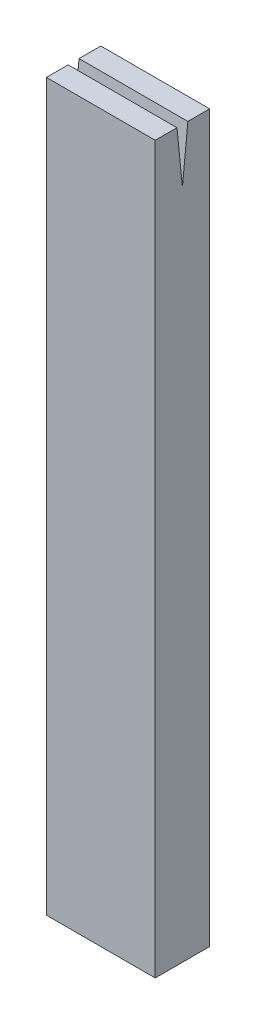
from build123d import *

# Parameters (mm, degrees)
SKETCH1_W           = 60
SKETCH1_H           = 30
BOSS_EXTRUDE1_DEPTH = 400
CUT_EXTRUDE1_DEPTH  = 60


with BuildPart() as part:
    # Sketch1 → Boss-Extrude1 (new body)
    with BuildSketch(Plane(origin=(0, 0, 0), x_dir=(1, 0, 0), z_dir=(0, 1, 0))):
        Rectangle(SKETCH1_W, SKETCH1_H)
    extrude(amount=BOSS_EXTRUDE1_DEPTH)

    # Sketch2 → Cut-Extrude1 (cut)
    with BuildSketch(Plane(origin=(30, 0, 0), x_dir=(0, 0, -1), z_dir=(1, 0, 0))):
        Polygon((-3, 400), (0, 370), (3, 400), align=None)
    extrude(amount=-CUT_EXTRUDE1_DEPTH, mode=Mode.SUBTRACT)


solid = part.part
